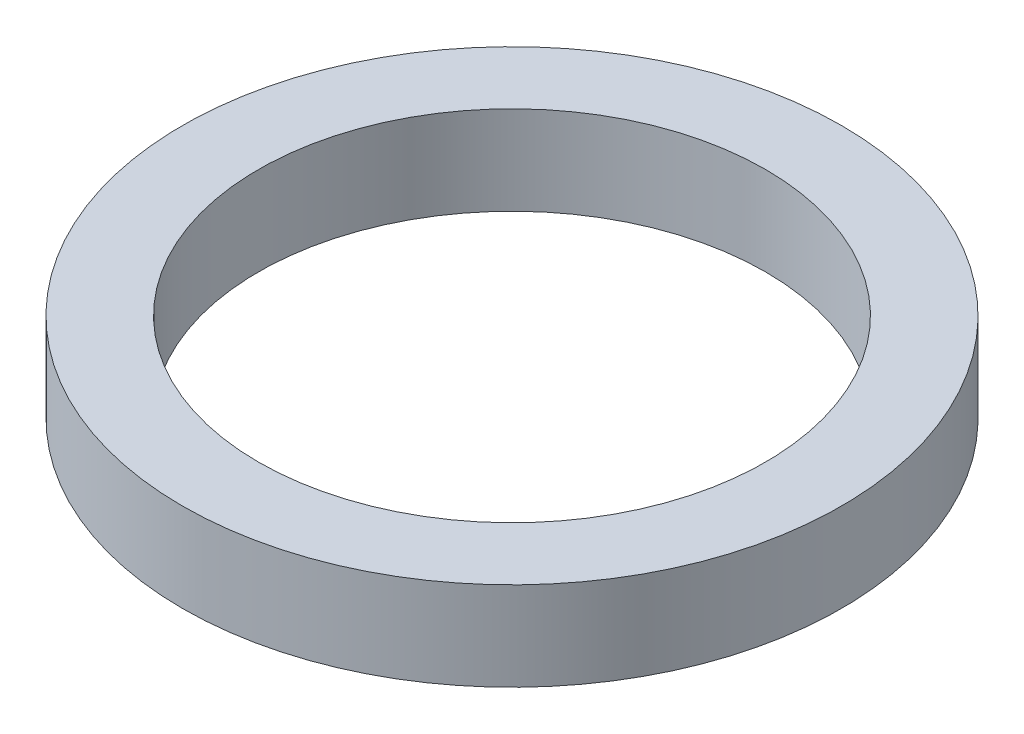
from build123d import *

# Parameters (mm, degrees)
SKETCH_1_R      = 26
SKETCH_1_R_2    = 20
EXTRUDE_1_DEPTH = 7


with BuildPart() as part:
    # 草图1 → 凸台-拉伸1 (new body)
    with BuildSketch(Plane(origin=(0, 0, 0), x_dir=(1, 0, 0), z_dir=(0, 1, 0))):
        with Locations(Location((0, 0, 0), (0, 0, 270))):
            Circle(SKETCH_1_R)
        with Locations(Location((0, 0, 0), (0, 0, 270))):
            Circle(SKETCH_1_R_2, mode=Mode.SUBTRACT)
    extrude(amount=EXTRUDE_1_DEPTH)


solid = part.part
